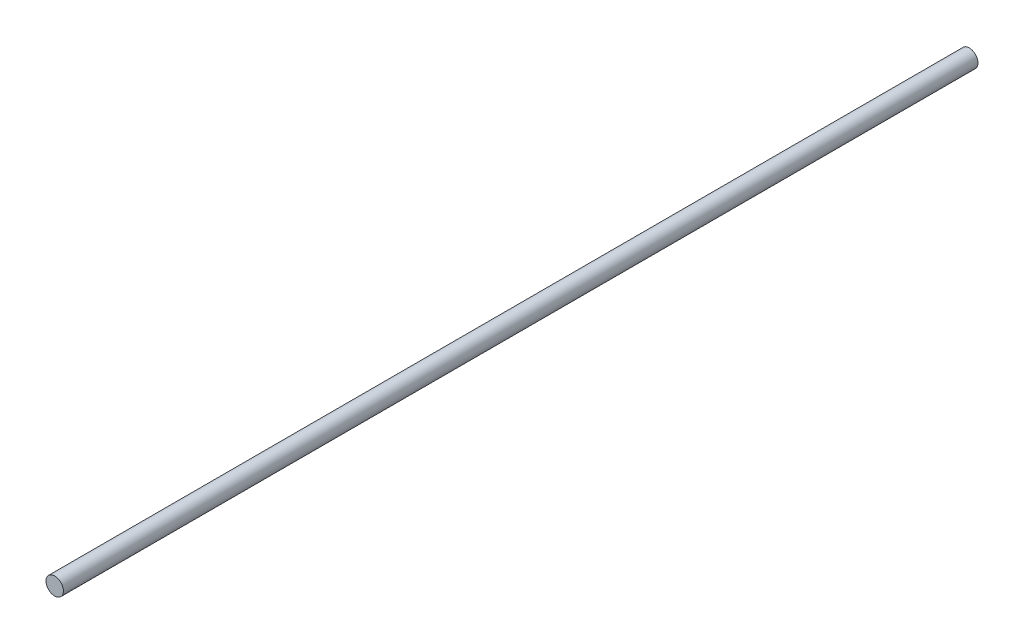
from build123d import *

# Parameters (mm, degrees)
SKETCH_1_R      = 2
EXTRUDE_1_DEPTH = 210


with BuildPart() as part:
    # 草图1 → 凸台-拉伸1 (new body)
    with BuildSketch(Plane.XY):
        Circle(SKETCH_1_R)
    extrude(amount=EXTRUDE_1_DEPTH)


solid = part.part
